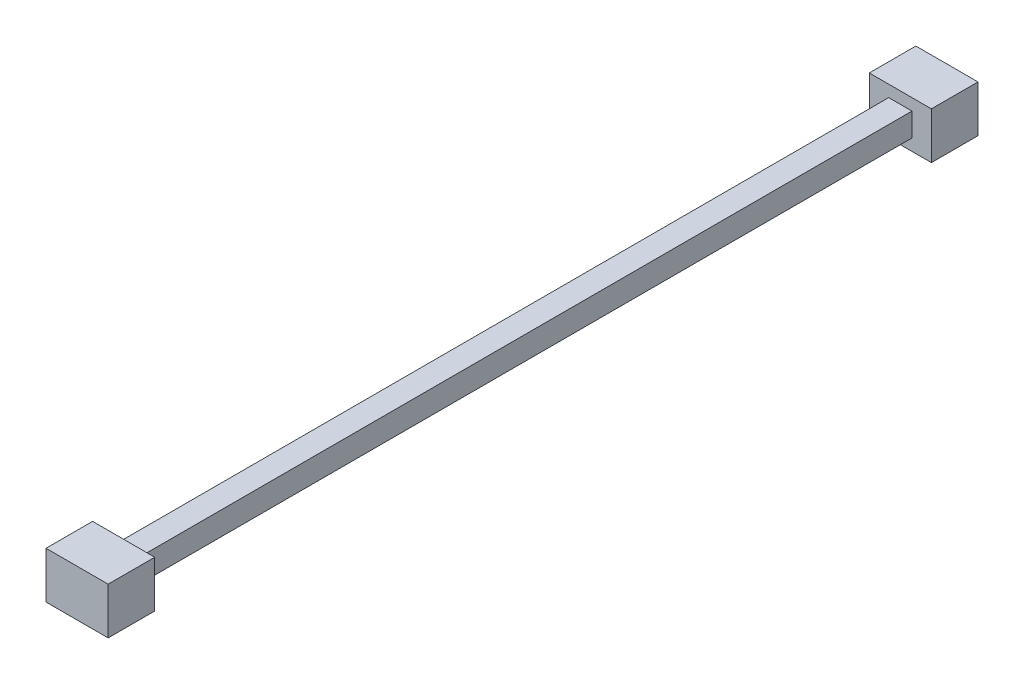
from build123d import *

# Parameters (mm, degrees)
SKETCH_1_W      = 15
SKETCH_1_H      = 15
EXTRUDE_1_DEPTH = 500
SKETCH_2_W      = 40
SKETCH_2_H      = 30
EXTRUDE_2_DEPTH = 30
SKETCH_3_W      = 40
SKETCH_3_H      = 30
EXTRUDE_3_DEPTH = 30


with BuildPart() as part:
    # 草图1 → 凸台-拉伸1 (new body)
    with BuildSketch(Plane.XY):
        Rectangle(SKETCH_1_W, SKETCH_1_H)
    extrude(amount=EXTRUDE_1_DEPTH)

    # 草图2 → 凸台-拉伸2 (add)
    with BuildSketch(Plane.XY.offset(500)):
        Rectangle(SKETCH_2_W, SKETCH_2_H)
    extrude(amount=EXTRUDE_2_DEPTH)

    # 草图3 → 凸台-拉伸3 (add)
    with BuildSketch(Plane(origin=(0, 0, 0), x_dir=(-1, 0, 0), z_dir=(0, 0, -1))):
        Rectangle(SKETCH_3_W, SKETCH_3_H)
    extrude(amount=EXTRUDE_3_DEPTH)


solid = part.part
